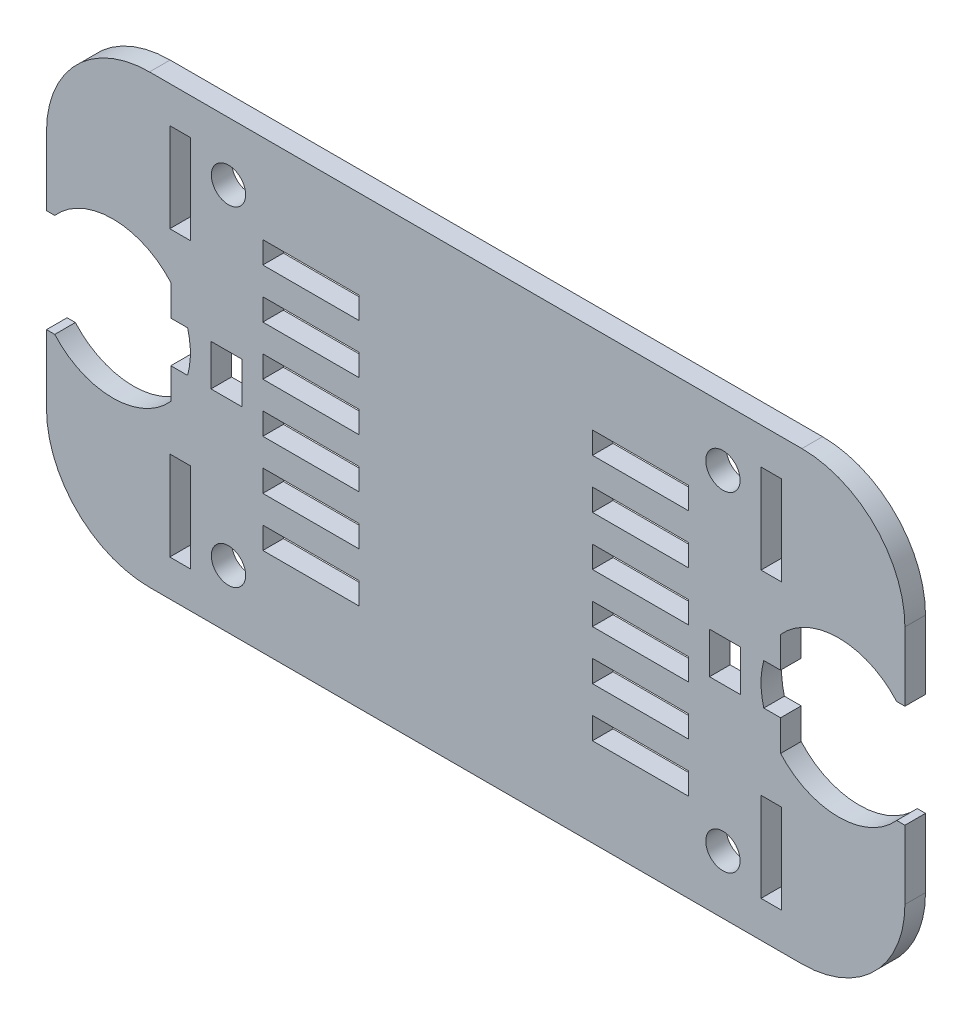
from build123d import *

# Parameters (mm, degrees)
SKICA2_R                = 2.5
SKICA2_W                = 4.5
SKICA2_H                = 6
SKICA2_W_2              = 3
SKICA2_H_2              = 13
SKICA2_W_3              = 14
SKICA2_H_3              = 3.2
P_IDAT_VYSUNUT_M1_DEPTH = 3
ZAOBLIT1_R              = 15


with BuildPart() as part:
    # Skica2 → Přidat vysunutím1 (new body)
    with BuildSketch(Plane.XY):
        with BuildLine():
            Line((-62.5, 7.5), (-61.3, 7.5))
            ThreePointArc((-61.3, 7.5), (-52.847781356, 11.3), (-44.395562713, 7.5))
            Line((-44.395562713, 7.5), (-44.395562713, 3))
            Line((-44.395562713, 3), (-41.953287334, 3))
            ThreePointArc((-41.953287334, 3), (-41.547781356, 0), (-41.953287334, -3))
            Line((-41.953287334, -3), (-44.395562713, -3))
            Line((-44.395562713, -3), (-44.395562713, -7.5))
            ThreePointArc((-44.395562713, -7.5), (-52.847781356, -11.3), (-61.3, -7.5))
            Line((-61.3, -7.5), (-62.5, -7.5))
            Line((-62.5, -7.5), (-62.5, -32.5))
            Line((-62.5, -32.5), (62.5, -32.5))
            Line((62.5, -32.5), (62.5, -7.5))
            Line((62.5, -7.5), (61.3, -7.5))
            ThreePointArc((61.3, -7.5), (52.847781356, -11.3), (44.395562713, -7.5))
            Line((44.395562713, -7.5), (44.395562713, -3))
            Line((44.395562713, -3), (41.953287334, -3))
            ThreePointArc((41.953287334, -3), (41.547781356, 0), (41.953287334, 3))
            Line((41.953287334, 3), (44.395562713, 3))
            Line((44.395562713, 3), (44.395562713, 7.5))
            ThreePointArc((44.395562713, 7.5), (52.847781356, 11.3), (61.3, 7.5))
            Line((61.3, 7.5), (62.5, 7.5))
            Line((62.5, 7.5), (62.5, 32.5))
            Line((62.5, 32.5), (-62.5, 32.5))
            Line((-62.5, 32.5), (-62.5, 7.5))
        make_face()
        with Locations((-36, 24)):
            Circle(SKICA2_R, mode=Mode.SUBTRACT)
        with Locations((36, 24)):
            Circle(SKICA2_R, mode=Mode.SUBTRACT)
        with Locations((-36, -24)):
            Circle(SKICA2_R, mode=Mode.SUBTRACT)
        with Locations((36, -24)):
            Circle(SKICA2_R, mode=Mode.SUBTRACT)
        with Locations((-36.297781356, 0)):
            Rectangle(SKICA2_W, SKICA2_H, mode=Mode.SUBTRACT)
        with Locations((-43.047781356, -20.7)):
            Rectangle(SKICA2_W_2, SKICA2_H_2, mode=Mode.SUBTRACT)
        with Locations((-43.047781356, 20.7)):
            Rectangle(SKICA2_W_2, SKICA2_H_2, mode=Mode.SUBTRACT)
        with Locations((43.047781356, -20.7)):
            Rectangle(SKICA2_W_2, SKICA2_H_2, mode=Mode.SUBTRACT)
        with Locations((43.047781356, 20.7)):
            Rectangle(SKICA2_W_2, SKICA2_H_2, mode=Mode.SUBTRACT)
        with Locations((36.297781356, 0)):
            Rectangle(SKICA2_W, SKICA2_H, mode=Mode.SUBTRACT)
        with Locations((-24, 18)):
            Rectangle(SKICA2_W_3, SKICA2_H_3, mode=Mode.SUBTRACT)
        with Locations((-24, 10.8)):
            Rectangle(SKICA2_W_3, SKICA2_H_3, mode=Mode.SUBTRACT)
        with Locations((-24, 3.6)):
            Rectangle(SKICA2_W_3, SKICA2_H_3, mode=Mode.SUBTRACT)
        with Locations((-24, -3.6)):
            Rectangle(SKICA2_W_3, SKICA2_H_3, mode=Mode.SUBTRACT)
        with Locations((-24, -10.8)):
            Rectangle(SKICA2_W_3, SKICA2_H_3, mode=Mode.SUBTRACT)
        with Locations((-24, -18)):
            Rectangle(SKICA2_W_3, SKICA2_H_3, mode=Mode.SUBTRACT)
        with Locations((24, -18)):
            Rectangle(SKICA2_W_3, SKICA2_H_3, mode=Mode.SUBTRACT)
        with Locations((24, -10.8)):
            Rectangle(SKICA2_W_3, SKICA2_H_3, mode=Mode.SUBTRACT)
        with Locations((24, -3.6)):
            Rectangle(SKICA2_W_3, SKICA2_H_3, mode=Mode.SUBTRACT)
        with Locations((24, 3.6)):
            Rectangle(SKICA2_W_3, SKICA2_H_3, mode=Mode.SUBTRACT)
        with Locations((24, 10.8)):
            Rectangle(SKICA2_W_3, SKICA2_H_3, mode=Mode.SUBTRACT)
        with Locations((24, 18)):
            Rectangle(SKICA2_W_3, SKICA2_H_3, mode=Mode.SUBTRACT)
    extrude(amount=P_IDAT_VYSUNUT_M1_DEPTH)

    # Zaoblit1
    zaoblit1_edges = [part.edges().sort_by_distance(p)[0] for p in [
        (-62.5, 32.5, 1.5),
        (62.5, 32.5, 1.5),
        (62.5, -32.5, 1.5),
        (-62.5, -32.5, 1.5),
    ]]
    fillet(zaoblit1_edges, radius=ZAOBLIT1_R)


solid = part.part
